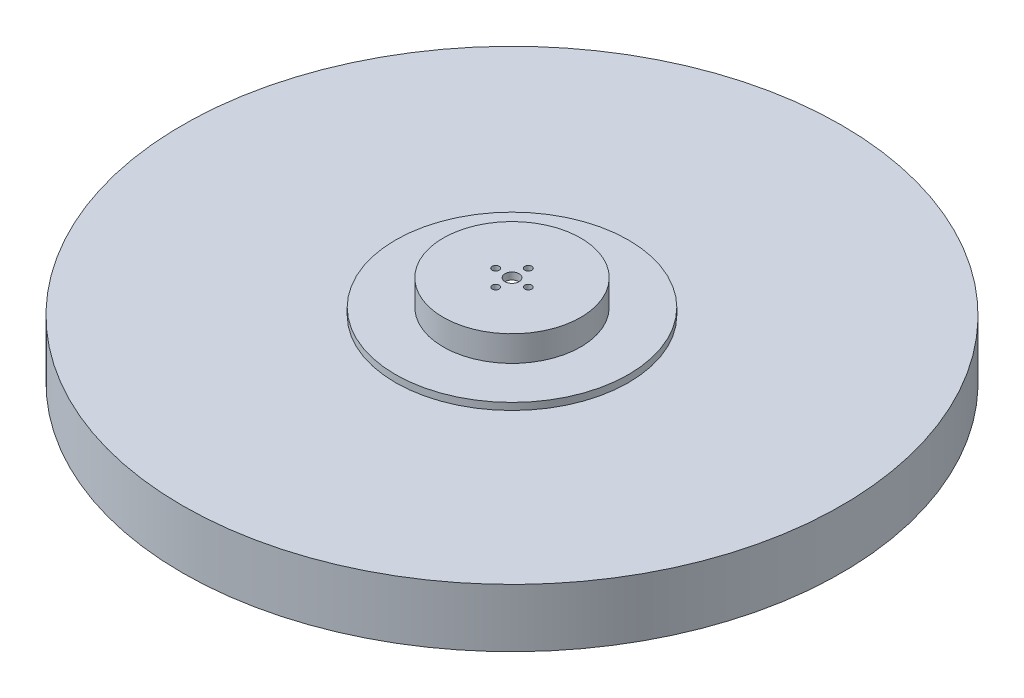
from build123d import *
from build123d.topology import SkipClean

# Parameters (mm, degrees)
SKETCH_1_R               = 141.4
EXTRUDE_1_DEPTH          = 5
SKETCH_2_R               = 50
EXTRUDE_2_DEPTH          = 3
SKETCH_3_R               = 29.5
EXTRUDE_3_DEPTH          = 11
SKETCH_4_R               = 27
CUT_EXTRUDE_1_DEPTH      = 16
SKETCH_5_R               = 3
SKETCH_5_R_2             = 1.5
CUT_EXTRUDE_2_DEPTH      = 201.608873184
EXTRUDE_START            = 20
EXTRUDE_1_2_DEPTH        = 20
PATTERN_CIRCULAR_1_COUNT = 6


with BuildPart() as part:
    # 草图1 → Extrude 1 (new body)
    with BuildSketch(Plane(origin=(0, 0, 0), x_dir=(1, 0, 0), z_dir=(0, 1, 0))):
        with Locations(Location((0, 0, 0), (0, 0, 270))):
            Circle(SKETCH_1_R)
    extrude(amount=EXTRUDE_1_DEPTH)

    # 草图2 → 凸台-拉伸2 (add)
    with BuildSketch(Plane(origin=(0, 5, 0), x_dir=(1, 0, 0), z_dir=(0, 1, 0))):
        with Locations(Location((0, 0, 0), (0, 0, 270))):
            Circle(SKETCH_2_R)
    extrude(amount=EXTRUDE_2_DEPTH)

    # 草图3 → 凸台-拉伸3 (add)
    with BuildSketch(Plane(origin=(0, 8, 0), x_dir=(1, 0, 0), z_dir=(0, 1, 0))):
        with Locations(Location((0, 0, 0), (0, 0, 270))):
            Circle(SKETCH_3_R)
    extrude(amount=EXTRUDE_3_DEPTH)

    # 草图4 → 切除-拉伸1 (cut)
    with BuildSketch(Plane.XZ):
        with Locations(Location((0, 0, 0), (0, 0, 270))):
            Circle(SKETCH_4_R)
    extrude(amount=-CUT_EXTRUDE_1_DEPTH, mode=Mode.SUBTRACT)

    # 草图5 → 切除-拉伸2 (cut, through all)
    with BuildSketch(Plane.XZ.offset(-16)):
        with Locations(Location((0, 0, 0), (0, 0, 270))):
            Circle(SKETCH_5_R)
        with Locations(Location((0, 7, 0), (0, 0, 270))):
            Circle(SKETCH_5_R_2)
        with Locations(Location((7, 0, 0), (0, 0, 270))):
            Circle(SKETCH_5_R_2)
        with Locations(Location((0, -7, 0), (0, 0, 270))):
            Circle(SKETCH_5_R_2)
        with Locations(Location((-7, 0, 0), (0, 0, 270))):
            Circle(SKETCH_5_R_2)
    extrude(amount=-CUT_EXTRUDE_2_DEPTH, mode=Mode.SUBTRACT)

    # 草图6 → Extrude 1 2 (add)
    with SkipClean():  # the faces are left unmerged after this step: merging them gives an invalid solid
        with BuildSketch(Plane.XZ.offset(EXTRUDE_START)):
            with BuildLine():
                Line((-23.382685902, 13.5), (-122.455992095, 70.7))
                ThreePointArc((-122.455992095, 70.7), (-70.7, 122.455992095), (0, 141.4))
                Line((0, 141.4), (0, 27))
                Line((0, 27), (-2, 27))
                Line((-2, 27), (-2, 139.385652059))
                ThreePointArc((-2, 139.385652059), (-69.7, 120.723941288), (-119.711515606, 71.424876837))
                Line((-119.711515606, 71.424876837), (-22.382685902, 15.232050808))
                Line((-22.382685902, 15.232050808), (-23.382685902, 13.5))
            make_face()
        extrude_1_2 = extrude(amount=-EXTRUDE_1_2_DEPTH)

    # 阵列(圆周)1: Extrude 1 2 ×6 about axis
    pattern_circular_1_axis = Axis((0, 0, 0), (0, 1, 0))
    for i in range(1, PATTERN_CIRCULAR_1_COUNT):
        add(extrude_1_2.rotate(pattern_circular_1_axis, i * 360 / PATTERN_CIRCULAR_1_COUNT))


solid = part.part
